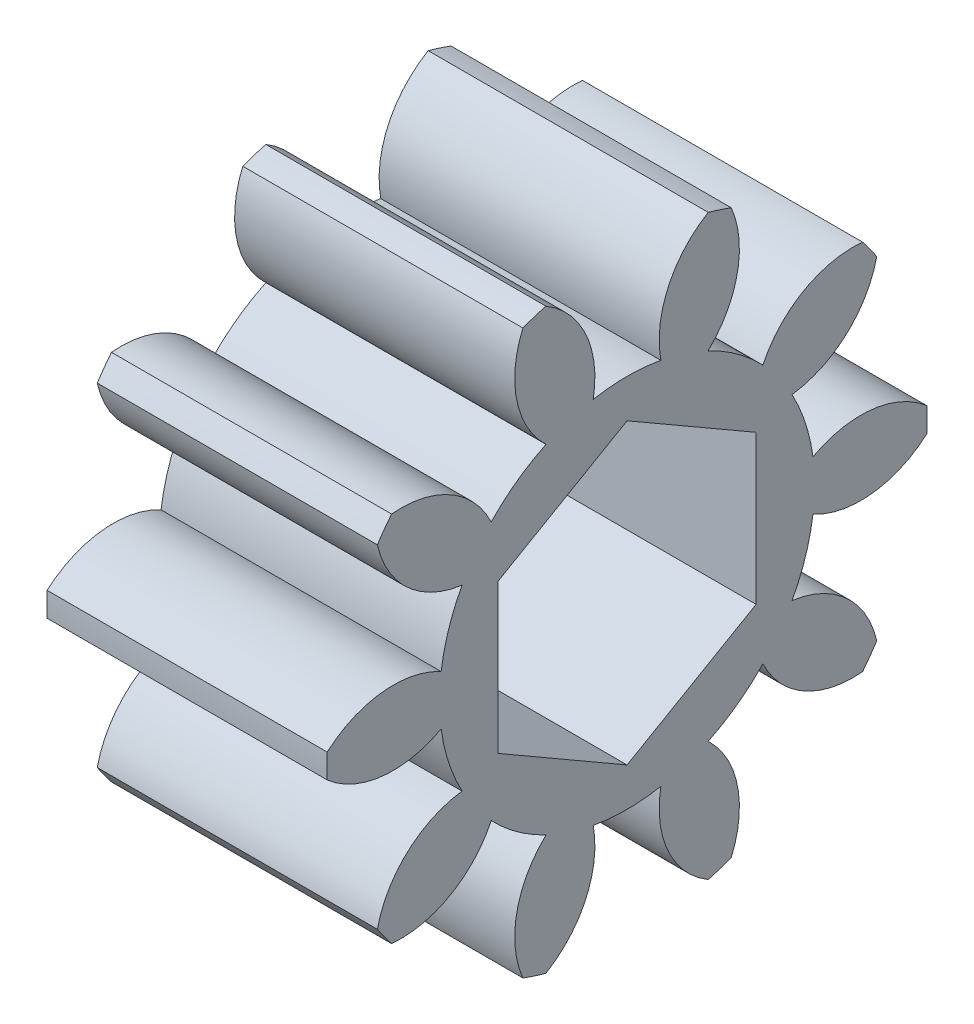
from build123d import *

# Parameters (mm, degrees)
BASPROSKE_W        = 14
BASPROSKE_H        = 15
TOOTHCUT_DEPTH     = 26.416530054
TEETHCUTS_COUNT    = 10
TEETHCUTS_ANGLE    = 324
BORSKE_R           = 5
BORE_DEPTH         = 50.0000508
CUT_EXTRUDE1_DEPTH = 26.09062294


with BuildPart() as part:
    # BasProSke → Base-Revolve (revolve)
    with BuildSketch(Plane(origin=(0, 0, 0), x_dir=(1, 0, 0), z_dir=(0, 1, 0)), mode=Mode.PRIVATE) as base_revolve_sk:
        with Locations((7, 7.5)):
            Rectangle(BASPROSKE_W, BASPROSKE_H)
    revolve(base_revolve_sk.sketch.rotate(Axis((-10, 0, 0), (1, 0, 0)), 180), axis=Axis((-10, 0, 0), (1, 0, 0)))

    # TooCutSke → ToothCut (cut, through all)
    with BuildSketch(Plane(origin=(0, 0, 0), x_dir=(0, 0, -1), z_dir=(1, 0, 0))):
        with BuildLine():
            ThreePointArc((1.691642647, 9.220098761), (0, 9.374), (-1.691642647, 9.220098761))
            ThreePointArc((-1.691642647, 9.220098761), (-2.059354944, 12.219114282), (-4.087513468, 14.458730194))
            ThreePointArc((-4.087513468, 14.458730194), (0, 15.0254), (4.087513468, 14.458730194))
            ThreePointArc((4.087513468, 14.458730194), (2.059354944, 12.219114282), (1.691642647, 9.220098761))
        make_face()
    toothcut = extrude(amount=TOOTHCUT_DEPTH, mode=Mode.SUBTRACT)

    # TeethCuts: ToothCut ×10 about axis
    teethcuts_axis = Axis((-10, 0, 0), (1, 0, 0))
    for i in range(1, TEETHCUTS_COUNT):
        add(toothcut.rotate(teethcuts_axis, i * TEETHCUTS_ANGLE / (TEETHCUTS_COUNT - 1)), mode=Mode.SUBTRACT)

    # BorSke → Bore (cut, symmetric)
    with BuildSketch(Plane(origin=(0, 0, 0), x_dir=(0, 0, -1), z_dir=(1, 0, 0))):
        with Locations(Location((0, 0, 0), (0, 0, 180))):
            Circle(BORSKE_R)
    extrude(amount=BORE_DEPTH, both=True, mode=Mode.SUBTRACT)

    # Sketch1 → Cut-Extrude1 (cut, through all)
    with BuildSketch(Plane(origin=(14, 0, 0), x_dir=(0, 0, -1), z_dir=(1, 0, 0))):
        Polygon((0, -7.447818473), (6.45, -3.723909236), (6.45, 3.723909236), (0, 7.447818473), (-6.45, 3.723909236), (-6.45, -3.723909236), align=None)
    extrude(amount=-CUT_EXTRUDE1_DEPTH, mode=Mode.SUBTRACT)


solid = part.part
